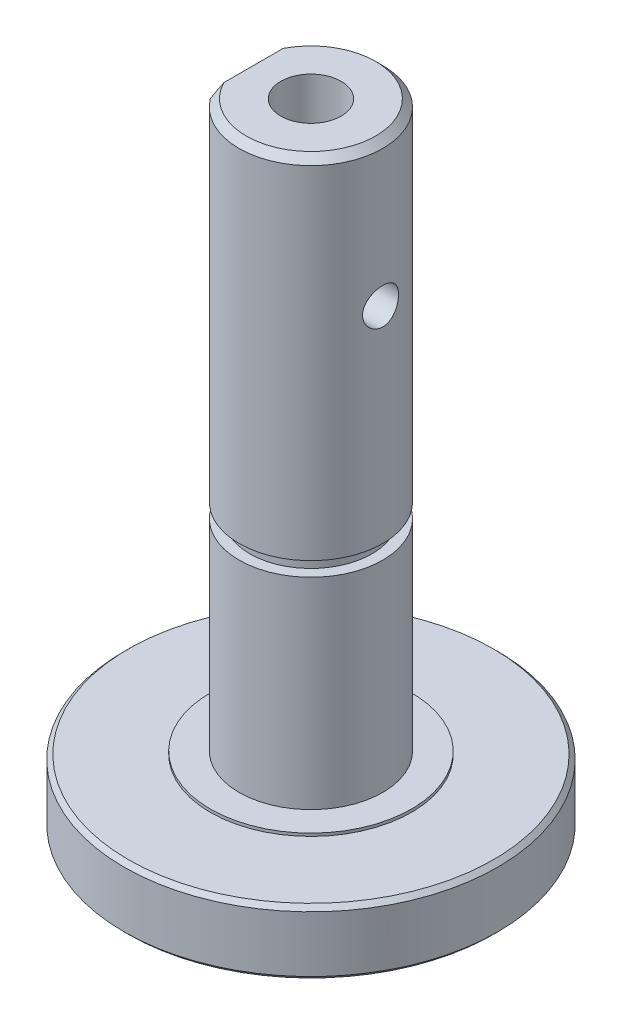
from build123d import *

# Parameters (mm, degrees)
CUT_EXTRUDE_START           = -20
CUT_EXTRUDE_1_DEPTH         = 20
HOLE_WIZARD_4_2_4_2_1_D     = 4.2
HOLE_WIZARD_4_2_4_2_1_DEPTH = 14
HOLE_WIZARD_4_2_4_2_1_TIP   = 1.2618073
HOLE_WIZARD_2_5_2_5_1_D     = 2.5
HOLE_WIZARD_2_5_2_5_1_DEPTH = 12.312546285
CHAMFER_1_SIZE              = 0.3
CHAMFER_2_SIZE              = 0.5


with BuildPart() as part:
    # 草图1 → 旋转1 (revolve)
    with BuildSketch(Plane(origin=(0, 0, 0), x_dir=(-1, 0, 0), z_dir=(0, 0, -1)), mode=Mode.PRIVATE) as revolve_1_sk:
        Polygon((-13, 0), (0, 0), (0, 44), (-5, 44), (-5, 19.7), (-4.25, 19.7), (-4.25, 18.7), (-5, 18.7), (-5, 4.7), (-7, 4.7), (-7, 4.5), (-13, 4.5), align=None)
    revolve(revolve_1_sk.sketch.rotate(Axis((0, 0, 0), (0, 1, 0)), 270), axis=Axis((0, 0, 0), (0, 1, 0)))

    # 草图2 → 切除-拉伸1 (cut)
    with BuildSketch(Plane(origin=(0, 44, 0), x_dir=(-1, 0, 0), z_dir=(0, 1, 0)).offset(CUT_EXTRUDE_START)):
        with BuildLine():
            Line((4, 3), (4, -3))
            ThreePointArc((4, -3), (5, 0), (4, 3))
        make_face()
    extrude(amount=CUT_EXTRUDE_1_DEPTH, mode=Mode.SUBTRACT)

    # Ø4.2 (4.2) 直径孔1
    with Locations(Plane(origin=(0, 44, 0), x_dir=(1, 0, 0), z_dir=(0, 1, 0))):
        with Locations((0, 0)):
            Hole(HOLE_WIZARD_4_2_4_2_1_D / 2, depth=HOLE_WIZARD_4_2_4_2_1_DEPTH)
            with Locations((0, 0, -(HOLE_WIZARD_4_2_4_2_1_DEPTH + HOLE_WIZARD_4_2_4_2_1_TIP / 2))):  # 118° drill point
                Cone(0, HOLE_WIZARD_4_2_4_2_1_D / 2, HOLE_WIZARD_4_2_4_2_1_TIP, mode=Mode.SUBTRACT)

    # Ø2.5 (2.5) 直径孔1
    with Locations(Plane.ZY.offset(4)):
        with Locations((0, 34)):
            Hole(HOLE_WIZARD_2_5_2_5_1_D / 2, depth=HOLE_WIZARD_2_5_2_5_1_DEPTH)

    # 倒角1
    chamfer_1_edges = [part.edges().sort_by_distance(p)[0] for p in [
        (0, 0, -13),
        (0, 4.5, -13),
    ]]
    chamfer(chamfer_1_edges, length=CHAMFER_1_SIZE)

    # 倒角2
    chamfer_2_edges = [part.edges().sort_by_distance(p)[0] for p in [
        (4.472135955, 44, -2.236067977),
    ]]
    chamfer(chamfer_2_edges, length=CHAMFER_2_SIZE)


solid = part.part
